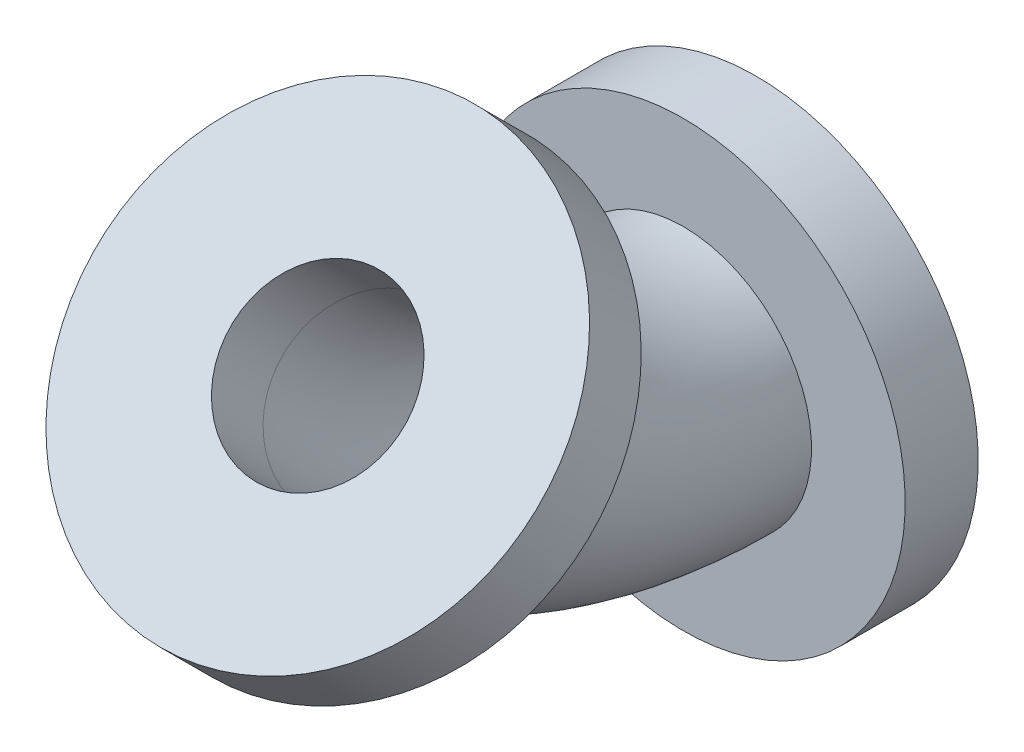
from build123d import *

# Parameters (mm, degrees)
ESQUISSE2_R             = 65
ESQUISSE2_R_2           = 44
BOSS_EXTRU_1_START      = -47
ESQUISSE3_R             = 112.5
ESQUISSE3_R_2           = 44
BOSS_EXTRU_1_DEPTH      = 47
ENL_V_START             = -10
ESQUISSE4_R             = 112.5
ESQUISSE4_R_2           = 65
ENL_V_MAT_EXTRU_1_DEPTH = 10
ESQUISSE5_R             = 112.5
ESQUISSE5_R_2           = 44
BOSS_EXTRU_2_DEPTH      = 37


with BuildPart() as part:
    # Balayage-Mince1: sweep along a path in Esquisse1
    with BuildLine(Plane(origin=(0, 0, 0), x_dir=(0, 0, -1), z_dir=(1, 0, 0))) as balayage_mince1_path:
        Line((0, 0), (-47, 0))
        ThreePointArc((-47, 0), (-133.103772282, 17.127105185), (-206.099025767, 65.900974233))
        Line((-206.099025767, 65.900974233), (-232.261976671, 92.063925137))
    # Esquisse2 → Balayage-Mince1 (sweep)
    with BuildSketch(Plane.XY):
        Circle(ESQUISSE2_R)
        Circle(ESQUISSE2_R_2, mode=Mode.SUBTRACT)
    sweep(path=balayage_mince1_path.line)

    # Esquisse3 → Boss.-Extru.1 (add)
    with BuildSketch(Plane(origin=(0, 0, 0), x_dir=(-1, 0, 0), z_dir=(0, 0, -1)).offset(BOSS_EXTRU_1_START)):
        Circle(ESQUISSE3_R)
        with Locations(Location((0, 0, 0), (0, 0, 180))):
            Circle(ESQUISSE3_R_2, mode=Mode.SUBTRACT)
    extrude(amount=BOSS_EXTRU_1_DEPTH)

    # Esquisse4 → Enlèv. mat.-Extru.1 (cut)
    with BuildSketch(Plane(origin=(0, 0, 0), x_dir=(-1, 0, 0), z_dir=(0, 0, -1)).offset(ENL_V_START)):
        Circle(ESQUISSE4_R)
        Circle(ESQUISSE4_R_2, mode=Mode.SUBTRACT)
    extrude(amount=ENL_V_MAT_EXTRU_1_DEPTH, mode=Mode.SUBTRACT)

    # Esquisse5 → Boss.-Extru.2 (add)
    with BuildSketch(Plane(origin=(0, 162.162950904, 162.162950904), x_dir=(1, 0, 0), z_dir=(0, 0.7071067811865472, 0.7071067811865478))):
        with Locations(Location((0, -99.134992949, 0), (0, 0, 270))):
            Circle(ESQUISSE5_R)
        with Locations(Location((0, -99.134992949, 0), (0, 0, 270))):
            Circle(ESQUISSE5_R_2, mode=Mode.SUBTRACT)
    extrude(amount=-BOSS_EXTRU_2_DEPTH)


solid = part.part
